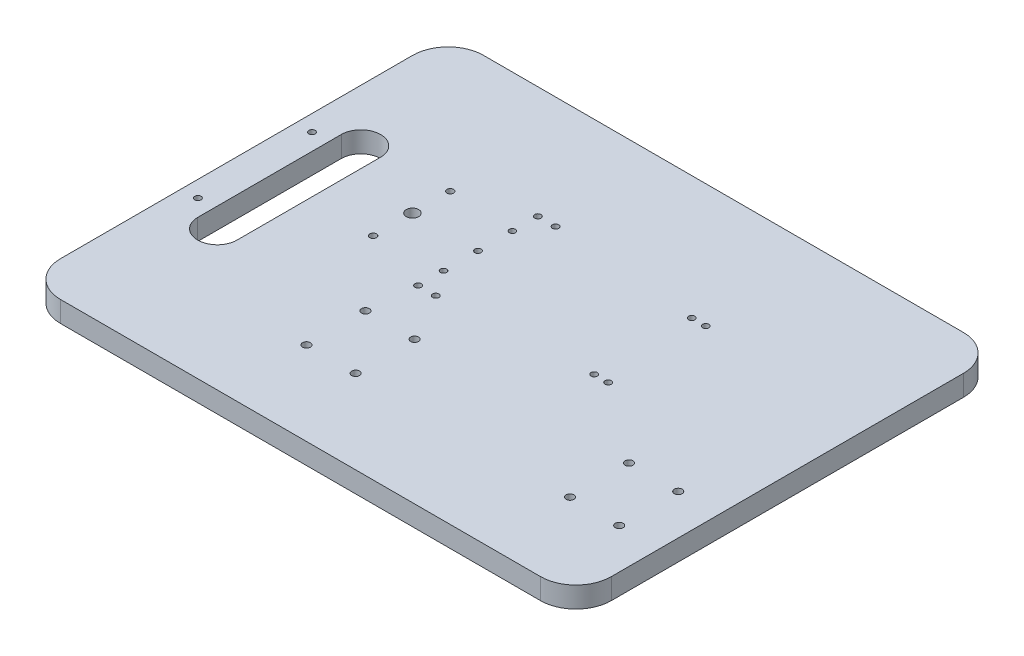
from build123d import *

# Parameters (mm, degrees)
SKETCH1_W           = 280
SKETCH1_H           = 215
BOSS_EXTRUDE1_DEPTH = 10.6
FILLET1_R           = 18
CUT_EXTRUDE1_DEPTH  = 177.829324491
SKETCH3_R           = 1.6
SKETCH3_R_2         = 3.15
SKETCH3_R_3         = 1.7
SKETCH3_R_4         = 1.55
SKETCH3_R_5         = 2
CUT_EXTRUDE2_DEPTH  = 177.829324491


with BuildPart() as part:
    # Sketch1 → Boss-Extrude1 (new body)
    with BuildSketch(Plane(origin=(0, 0, 0), x_dir=(1, 0, 0), z_dir=(0, 1, 0))):
        Rectangle(SKETCH1_W, SKETCH1_H)
    extrude(amount=BOSS_EXTRUDE1_DEPTH)

    # Fillet1
    fillet1_edges = [part.edges().sort_by_distance(p)[0] for p in [
        (-140, 5.3, -107.5),
        (140, 5.3, -107.5),
        (140, 5.3, 107.5),
        (-140, 5.3, 107.5),
    ]]
    fillet(fillet1_edges, radius=FILLET1_R)

    # Sketch2 → Cut-Extrude1 (cut, through all)
    with BuildSketch(Plane(origin=(0, 10.6, 0), x_dir=(1, 0, 0), z_dir=(0, 1, 0))):
        with BuildLine():
            Line((-123.3, -36.5), (-123.3, 36.5))
            ThreePointArc((-123.3, 36.5), (-113.3, 46.5), (-103.3, 36.5))
            Line((-103.3, 36.5), (-103.3, -36.5))
            ThreePointArc((-103.3, -36.5), (-113.3, -46.5), (-123.3, -36.5))
        make_face()
    extrude(amount=-CUT_EXTRUDE1_DEPTH, mode=Mode.SUBTRACT)

    # Sketch3 → Cut-Extrude2 (cut, through all)
    with BuildSketch(Plane(origin=(0, 10.6, 0), x_dir=(1, 0, 0), z_dir=(0, 1, 0))):
        with Locations(Location((-131.75, -27.9, 0), (0, 0, 270))):
            Circle(SKETCH3_R)
        with Locations(Location((-131.75, 30.1, 0), (0, 0, 270))):
            Circle(SKETCH3_R)
        with Locations(Location((-70.6, 20, 0), (0, 0, 270))):
            Circle(SKETCH3_R_2)
        with Locations(Location((-70.6, 0, 0), (0, 0, 270))):
            Circle(SKETCH3_R_3)
        with Locations(Location((-28.3, -10.442748969, 0), (0, 0, 270))):
            Circle(SKETCH3_R)
        with Locations(Location((-37.3, -10.442748969, 0), (0, 0, 270))):
            Circle(SKETCH3_R)
        with Locations(Location((-37.3, 2.5, 0), (0, 0, 270))):
            Circle(SKETCH3_R_4)
        with Locations(Location((-37.3, 20, 0), (0, 0, 270))):
            Circle(SKETCH3_R)
        with Locations(Location((-37.3, 37.5, 0), (0, 0, 270))):
            Circle(SKETCH3_R_4)
        with Locations(Location((-28.3, 50.442748969, 0), (0, 0, 270))):
            Circle(SKETCH3_R)
        with Locations(Location((-37.3, 50.442748969, 0), (0, 0, 270))):
            Circle(SKETCH3_R)
        with Locations(Location((46.6, -4.8, 0), (0, 0, 270))):
            Circle(SKETCH3_R)
        with Locations(Location((46.6, 44.8, 0), (0, 0, 270))):
            Circle(SKETCH3_R)
        with Locations(Location((-70.6, 39.2, 0), (0, 0, 270))):
            Circle(SKETCH3_R_3)
        with Locations(Location((53.7, 44.8, 0), (0, 0, 270))):
            Circle(SKETCH3_R)
        with Locations(Location((53.7, -4.8, 0), (0, 0, 270))):
            Circle(SKETCH3_R)
        with Locations(Location((-39.5, -35, 0), (0, 0, 270))):
            Circle(SKETCH3_R_5)
        with Locations(Location((-14.5, -35, 0), (0, 0, 270))):
            Circle(SKETCH3_R_5)
        with Locations(Location((-39.5, -65, 0), (0, 0, 270))):
            Circle(SKETCH3_R_5)
        with Locations(Location((-14.5, -65, 0), (0, 0, 270))):
            Circle(SKETCH3_R_5)
        with Locations(Location((94.5, -35, 0), (0, 0, 270))):
            Circle(SKETCH3_R_5)
        with Locations(Location((119.5, -35, 0), (0, 0, 270))):
            Circle(SKETCH3_R_5)
        with Locations(Location((94.5, -65, 0), (0, 0, 270))):
            Circle(SKETCH3_R_5)
        with Locations(Location((119.5, -65, 0), (0, 0, 270))):
            Circle(SKETCH3_R_5)
    extrude(amount=-CUT_EXTRUDE2_DEPTH, mode=Mode.SUBTRACT)


solid = part.part
